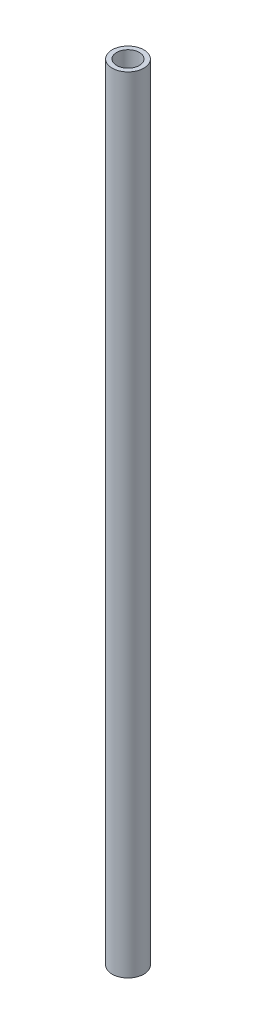
from build123d import *

# Parameters (mm, degrees)
ESQUISSE1_R        = 3.5
ESQUISSE1_R_2      = 2.5
BOSS_EXTRU_1_DEPTH = 173


with BuildPart() as part:
    # Esquisse1 → Boss.-Extru.1 (new body)
    with BuildSketch(Plane(origin=(0, 0, 0), x_dir=(1, 0, 0), z_dir=(0, 1, 0))):
        with Locations(Location((0, 0, 0), (0, 0, 270))):
            Circle(ESQUISSE1_R)
        with Locations(Location((0, 0, 0), (0, 0, 270))):
            Circle(ESQUISSE1_R_2, mode=Mode.SUBTRACT)
    extrude(amount=BOSS_EXTRU_1_DEPTH)


solid = part.part
